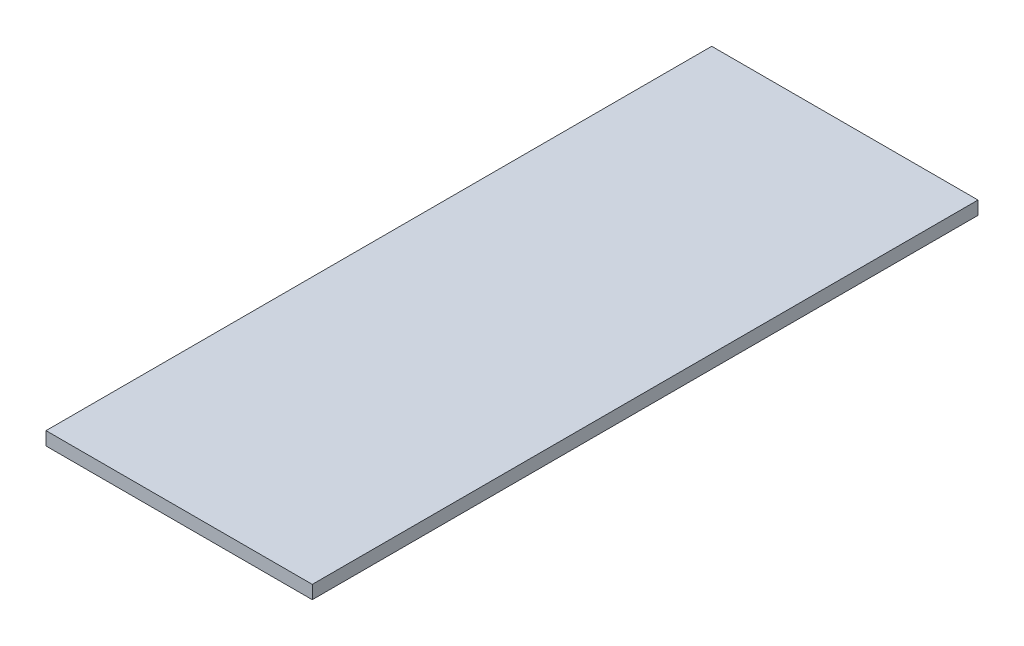
from build123d import *

# Parameters (mm, degrees)
ESBO_O1_W                = 20
ESBO_O1_H                = 50
RESSALTO_EXTRUS_O1_DEPTH = 1


with BuildPart() as part:
    # Esboço1 → Ressalto-extrusão1 (new body)
    with BuildSketch(Plane(origin=(0, 0, 0), x_dir=(1, 0, 0), z_dir=(0, 1, 0))):
        Rectangle(ESBO_O1_W, ESBO_O1_H)
    extrude(amount=RESSALTO_EXTRUS_O1_DEPTH)


solid = part.part
